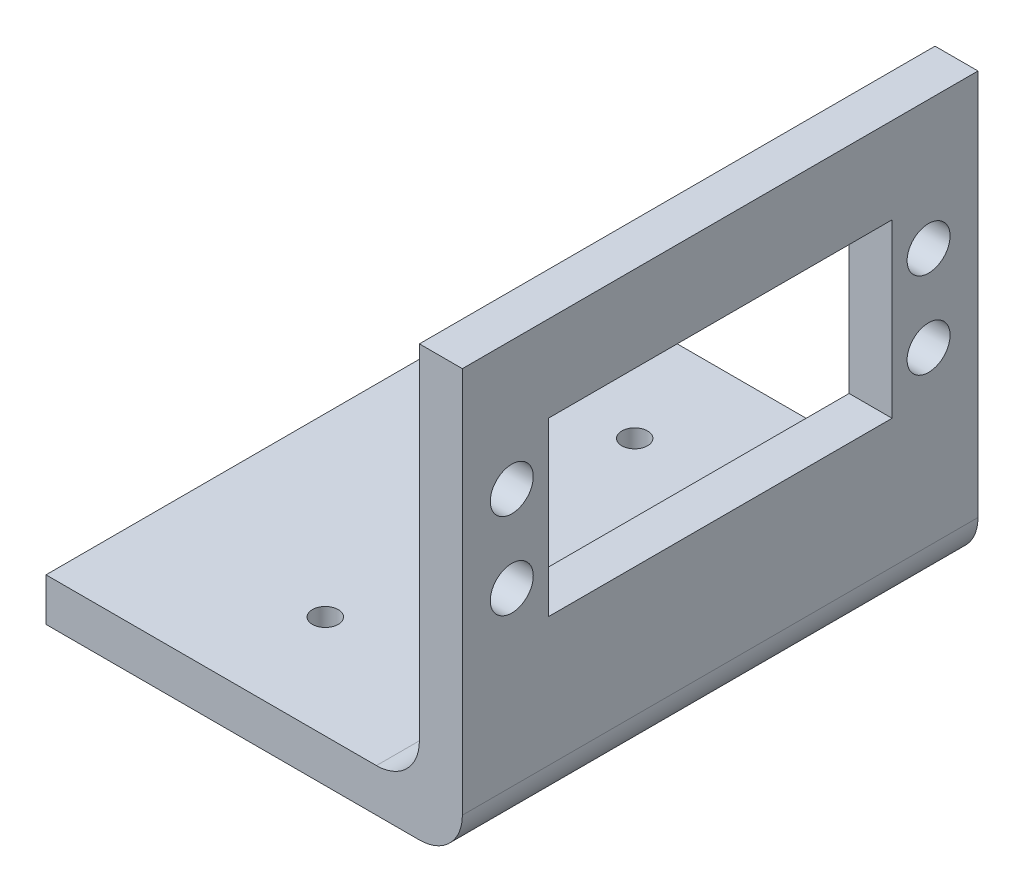
from build123d import *

# Parameters (mm, degrees)
BOSS_EXTRUDE1_DEPTH = 60
SKETCH2_R           = 2.5
SKETCH2_W           = 40
SKETCH2_H           = 20
CUT_EXTRUDE1_DEPTH  = 10
SKETCH3_R           = 1.5
CUT_EXTRUDE2_DEPTH  = 10
RIB1_REACH          = 77.812
SKETCH4_WALL_W      = 174.836453632
SKETCH4_WALL_H      = 10
FILLET1_R           = 5


with BuildPart() as part:
    # Sketch1 → Boss-Extrude1 (new body)
    with BuildSketch(Plane.XY):
        Polygon((0, 0), (0, 50), (-5, 50), (-5, 5), (-48.45, 5), (-48.45, 0), align=None)
    extrude(amount=-BOSS_EXTRUDE1_DEPTH)

    # Sketch2 → Cut-Extrude1 (cut)
    with BuildSketch(Plane(origin=(0, 0, 0), x_dir=(0, 0, -1), z_dir=(1, 0, 0))):
        with Locations((54.25, 35)):
            Circle(SKETCH2_R)
        with Locations(Location((54.25, 25, 0), (0, 0, 270))):
            Circle(SKETCH2_R)
        with Locations((5.75, 25)):
            Circle(SKETCH2_R)
        with Locations(Location((5.75, 35, 0), (0, 0, 270))):
            Circle(SKETCH2_R)
        with Locations((30, 30)):
            Rectangle(SKETCH2_W, SKETCH2_H)
    extrude(amount=-CUT_EXTRUDE1_DEPTH, mode=Mode.SUBTRACT)

    # Sketch3 → Cut-Extrude2 (cut)
    with BuildSketch(Plane.XZ):
        with Locations(Location((-27.95, -30, 0), (0, 0, 270))):
            Circle(SKETCH3_R)
        with Locations(Location((-27.95, -12, 0), (0, 0, 270))):
            Circle(SKETCH3_R)
        with Locations(Location((-27.95, -48, 0), (0, 0, 270))):
            Circle(SKETCH3_R)
    extrude(amount=-CUT_EXTRUDE2_DEPTH, mode=Mode.SUBTRACT)

    # Sketch4 wall → Rib1 (add, up to next)
    with BuildSketch(Plane(origin=(-12.5, 12.5, -30), x_dir=(-0.707106781187, -0.707106781187, 0), z_dir=(0.707106781187, -0.707106781187, 0)), mode=Mode.PRIVATE) as rib1_sk1:
        Rectangle(SKETCH4_WALL_W, SKETCH4_WALL_H)
    rib1_tool1 = extrude(rib1_sk1.sketch, amount=RIB1_REACH, mode=Mode.PRIVATE) - part.part
    add(rib1_tool1.solids().sort_by_distance((-12.5, 12.5, -30))[0])

    # Fillet1
    fillet1_edges = [part.edges().sort_by_distance(p)[0] for p in [
        (-5, 5, -47.5),
        (0, 0, -30),
        (-5, 5, -12.5),
    ]]
    fillet(fillet1_edges, radius=FILLET1_R)


solid = part.part
